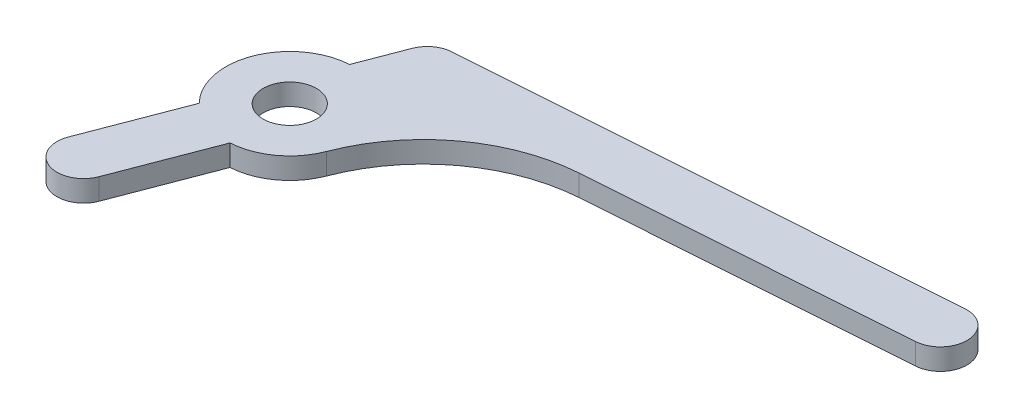
from build123d import *

# Parameters (mm, degrees)
BOSS_EXTRUDE1_DEPTH = 2.54


with BuildPart() as part:
    # Sketch1 → Boss-Extrude1 (new body)
    with BuildSketch(Plane(origin=(0, 0, 0), x_dir=(1, 0, 0), z_dir=(0, 1, 0))):
        with BuildLine():
            Line((-5.44692552, -5.352823265), (-2.9654485, 1.134345711))
            Line((-2.9654485, 1.134345711), (-0.48397148, 7.621514688))
            ThreePointArc((-0.48397148, 7.621514688), (-7.132828761, 2.728455313), (-5.44692552, -5.352823265))
        make_face()
        with BuildLine():
            ThreePointArc((-2.9654485, 1.134345711), (1.134345711, 2.9654485), (2.9654485, -1.134345711))
            Line((2.9654485, -1.134345711), (5.44692552, 5.352823265))
            ThreePointArc((5.44692552, 5.352823265), (2.728455313, 7.132828761), (-0.48397148, 7.621514688))
            Line((-0.48397148, 7.621514688), (-2.9654485, 1.134345711))
        make_face()
        with BuildLine():
            Line((0.48397148, -7.621514688), (2.9654485, -1.134345711))
            ThreePointArc((2.9654485, -1.134345711), (-1.134345711, -2.9654485), (-2.9654485, 1.134345711))
            Line((-2.9654485, 1.134345711), (-5.44692552, -5.352823265))
            ThreePointArc((-5.44692552, -5.352823265), (-2.728455313, -7.132828761), (0.48397148, -7.621514688))
        make_face()
        with BuildLine():
            Line((5.44692552, 5.352823265), (2.9654485, -1.134345711))
            Line((2.9654485, -1.134345711), (0.48397148, -7.621514688))
            ThreePointArc((0.48397148, -7.621514688), (4.526523941, -6.150796334), (7.132828761, -2.728455313))
            ThreePointArc((7.132828761, -2.728455313), (7.50979921, -1.387310475), (7.636865491, 0))
            ThreePointArc((7.636865491, 0), (7.068208828, 2.891736243), (5.44692552, 5.352823265))
        make_face()
        with BuildLine():
            ThreePointArc((-0.48397148, 7.621514688), (2.728455313, 7.132828761), (5.44692552, 5.352823265))
            Line((5.44692552, 5.352823265), (6.780173427, 8.83824924))
            Line((6.780173427, 8.83824924), (4.762569184, 8.69478972))
            ThreePointArc((4.762569184, 8.69478972), (1.987351058, 9.970243609), (1.571934345, 12.996139712))
            Line((1.571934345, 12.996139712), (-0.48397148, 7.621514688))
        make_face()
        with BuildLine():
            Line((7.502831345, 10.727448289), (6.780173427, 8.83824924))
            Line((6.780173427, 8.83824924), (24.416674474, 10.092273154))
            Line((24.416674474, 10.092273154), (61.912569184, 12.758377306))
            ThreePointArc((61.912569184, 12.758377306), (64.854387126, 16.150567925), (61.462196506, 19.092385867))
            Line((61.462196506, 19.092385867), (4.312196506, 15.028798281))
            ThreePointArc((4.312196506, 15.028798281), (7.087414633, 13.753344392), (7.502831345, 10.727448289))
        make_face()
        with BuildLine():
            Line((6.780173427, 8.83824924), (5.44692552, 5.352823265))
            ThreePointArc((5.44692552, 5.352823265), (7.068208828, 2.891736243), (7.636865491, 0))
            ThreePointArc((7.636865491, 0), (7.50979921, -1.387310475), (7.132828761, -2.728455313))
            ThreePointArc((7.132828761, -2.728455313), (13.906300834, 6.200799727), (24.416674474, 10.092273154))
            Line((24.416674474, 10.092273154), (6.780173427, 8.83824924))
        make_face()
        with BuildLine():
            Line((4.762569184, 8.69478972), (6.780173427, 8.83824924))
            Line((6.780173427, 8.83824924), (7.502831345, 10.727448289))
            ThreePointArc((7.502831345, 10.727448289), (7.087414633, 13.753344392), (4.312196506, 15.028798281))
            ThreePointArc((4.312196506, 15.028798281), (2.645832454, 14.411825788), (1.571934345, 12.996139712))
            ThreePointArc((1.571934345, 12.996139712), (1.987351058, 9.970243609), (4.762569184, 8.69478972))
        make_face()
        with BuildLine():
            Line((-3.840625768, -18.927036712), (0.48397148, -7.621514688))
            ThreePointArc((0.48397148, -7.621514688), (-2.728455313, -7.132828761), (-5.44692552, -5.352823265))
            Line((-5.44692552, -5.352823265), (-9.771522768, -16.65834529))
            ThreePointArc((-9.771522768, -16.65834529), (-7.940419979, -20.758139501), (-3.840625768, -18.927036712))
        make_face()
    extrude(amount=BOSS_EXTRUDE1_DEPTH)


solid = part.part
